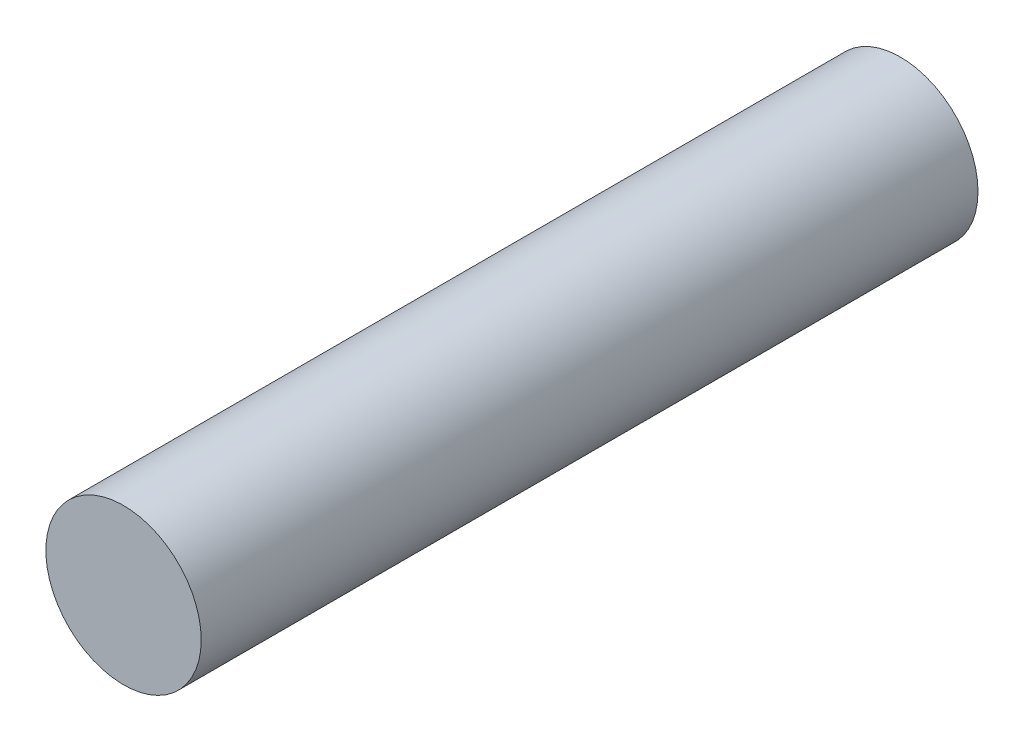
from build123d import *

# Parameters (mm, degrees)
SKETCH_1_R      = 20
EXTRUDE_1_DEPTH = 200


with BuildPart() as part:
    # 스케치1 → 보스-돌출1 (new body)
    with BuildSketch(Plane.XY):
        Circle(SKETCH_1_R)
    extrude(amount=EXTRUDE_1_DEPTH)


solid = part.part
